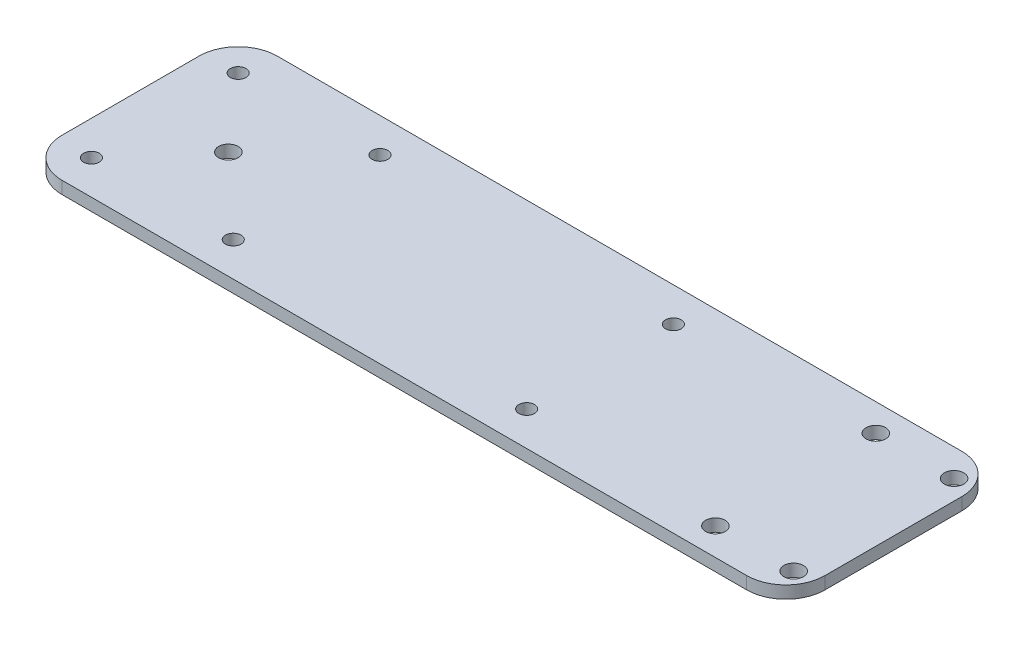
from build123d import *

# Parameters (mm, degrees)
SKETCH1_W             = 195
SKETCH1_H             = 55
BOSS_EXTRUDE1_DEPTH   = 3.175
FILLET1_R             = 10
F_5_0MM_DOWEL_HOLE1_D = 5
F_4_0MM_DOWEL_HOLE1_D = 4
F_5_0MM_DOWEL_HOLE2_D = 5


with BuildPart() as part:
    # Sketch1 → Boss-Extrude1 (new body)
    with BuildSketch(Plane(origin=(0, 0, 0), x_dir=(1, 0, 0), z_dir=(0, 1, 0))):
        with Locations((72.5, 0)):
            Rectangle(SKETCH1_W, SKETCH1_H)
    extrude(amount=BOSS_EXTRUDE1_DEPTH)

    # Fillet1
    fillet1_edges = [part.edges().sort_by_distance(p)[0] for p in [
        (-25, 1.5875, -27.5),
        (170, 1.5875, -27.5),
        (170, 1.5875, 27.5),
        (-25, 1.5875, 27.5),
    ]]
    fillet(fillet1_edges, radius=FILLET1_R)

    # Ø5.0mm Dowel Hole1 (through all)
    with Locations(Plane(origin=(0, 3.175, 0), x_dir=(1, 0, 0), z_dir=(0, 1, 0))):
        with Locations((0, 0)):
            Hole(F_5_0MM_DOWEL_HOLE1_D / 2)

    # Ø4.0mm Dowel Hole1 (through all)
    with Locations(Plane(origin=(0, 3.175, 0), x_dir=(1, 0, 0), z_dir=(0, 1, 0))):
        with Locations((-16.25, -18.75), (20, -18.75), (95, -18.75), (95, 18.75), (20, 18.75), (-16.25, 18.75)):
            Hole(F_4_0MM_DOWEL_HOLE1_D / 2)

    # Ø5.0mm Dowel Hole2 (through all)
    with Locations(Plane(origin=(0, 3.175, 0), x_dir=(1, 0, 0), z_dir=(0, 1, 0))):
        with Locations((165, 20.5), (145, 20.5), (165, -20.5), (145, -20.5)):
            Hole(F_5_0MM_DOWEL_HOLE2_D / 2)


solid = part.part
